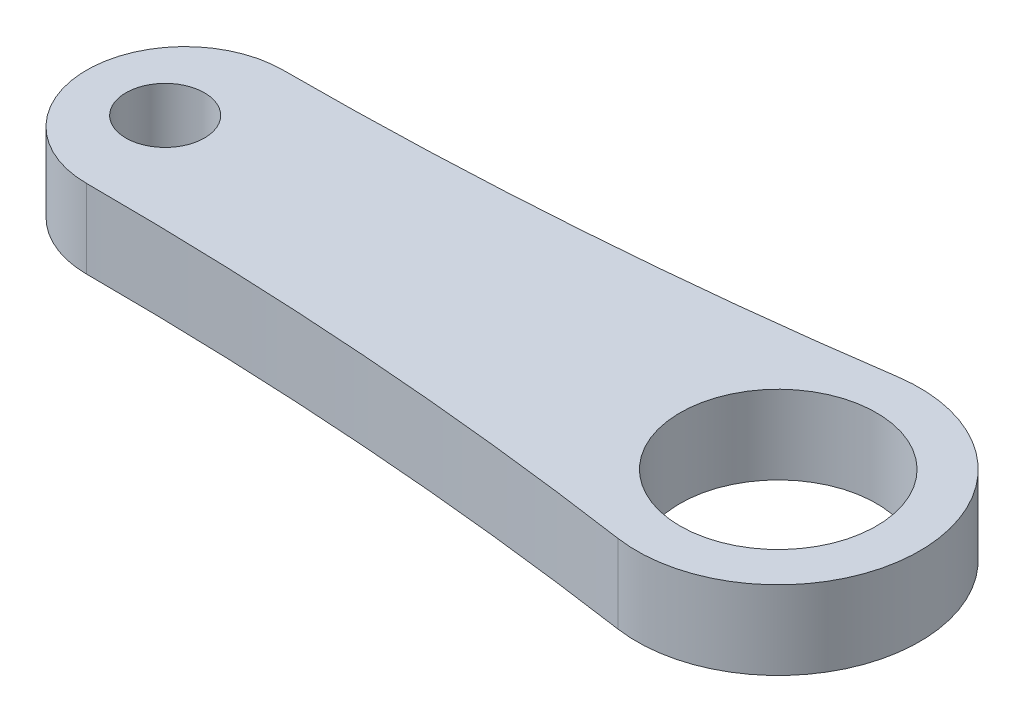
from build123d import *

# Parameters (mm, degrees)
CROQUIS1_R              = 2.5
CROQUIS1_R_2            = 1
SALIENTE_EXTRUIR1_DEPTH = 2
REDONDEO1_R             = 101


with BuildPart() as part:
    # Croquis1 → Saliente-Extruir1 (new body)
    with BuildSketch(Plane(origin=(0, 44.435642752, 0), x_dir=(1, 0, 0), z_dir=(0, 1, 0))):
        with BuildLine():
            Line((-19.765786092, -16.344915397), (-7.245908087, -16.344915397))
            ThreePointArc((-7.245908087, -16.344915397), (-1.055541318, -18.844915397), (-7.245908087, -21.344915397))
            Line((-7.245908087, -21.344915397), (-19.765786092, -21.344915397))
            ThreePointArc((-19.765786092, -21.344915397), (-22.265786092, -18.844915397), (-19.765786092, -16.344915397))
        make_face()
        with Locations(Location((-4.655541318, -18.844915397, 0), (0, 0, 270))):
            Circle(CROQUIS1_R, mode=Mode.SUBTRACT)
        with Locations(Location((-20.265786092, -18.844915397, 0), (0, 0, 270))):
            Circle(CROQUIS1_R_2, mode=Mode.SUBTRACT)
    extrude(amount=SALIENTE_EXTRUIR1_DEPTH)

    # Redondeo1
    redondeo1_edges = [part.edges().sort_by_distance(p)[0] for p in [
        (-7.245908087, 45.435642752, 16.344915397),
        (-7.245908087, 45.435642752, 21.344915397),
    ]]
    fillet(redondeo1_edges, radius=REDONDEO1_R)


solid = part.part
